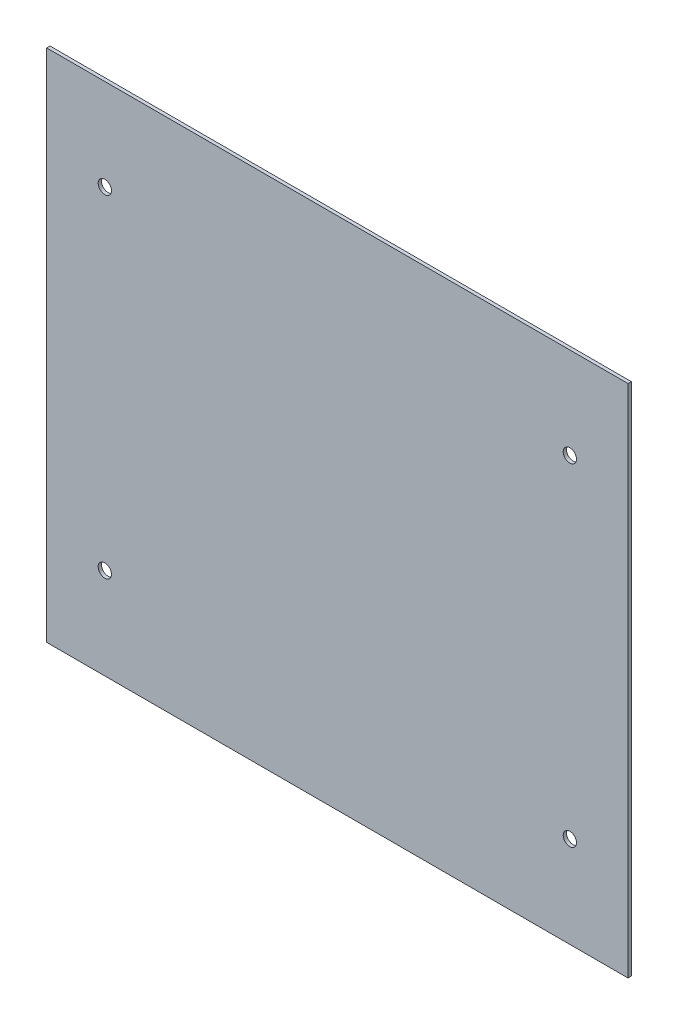
from build123d import *

# Parameters (mm, degrees)
SKETCH1_W           = 350
SKETCH1_H           = 310
BOSS_EXTRUDE1_DEPTH = 2
SKETCH2_R           = 4
CUT_EXTRUDE1_DEPTH  = 234.781949688


with BuildPart() as part:
    # Sketch1 → Boss-Extrude1 (new body)
    with BuildSketch(Plane.XY):
        Rectangle(SKETCH1_W, SKETCH1_H)
    extrude(amount=BOSS_EXTRUDE1_DEPTH)

    # Sketch2 → Cut-Extrude1 (cut, through all)
    with BuildSketch(Plane.XY.offset(2)):
        with Locations((-140, 100)):
            Circle(SKETCH2_R)
        with Locations(Location((-140, -100, 0), (0, 0, 180))):
            Circle(SKETCH2_R)
        with Locations((140, -100)):
            Circle(SKETCH2_R)
        with Locations(Location((140, 100, 0), (0, 0, 180))):
            Circle(SKETCH2_R)
    extrude(amount=-CUT_EXTRUDE1_DEPTH, mode=Mode.SUBTRACT)


solid = part.part
